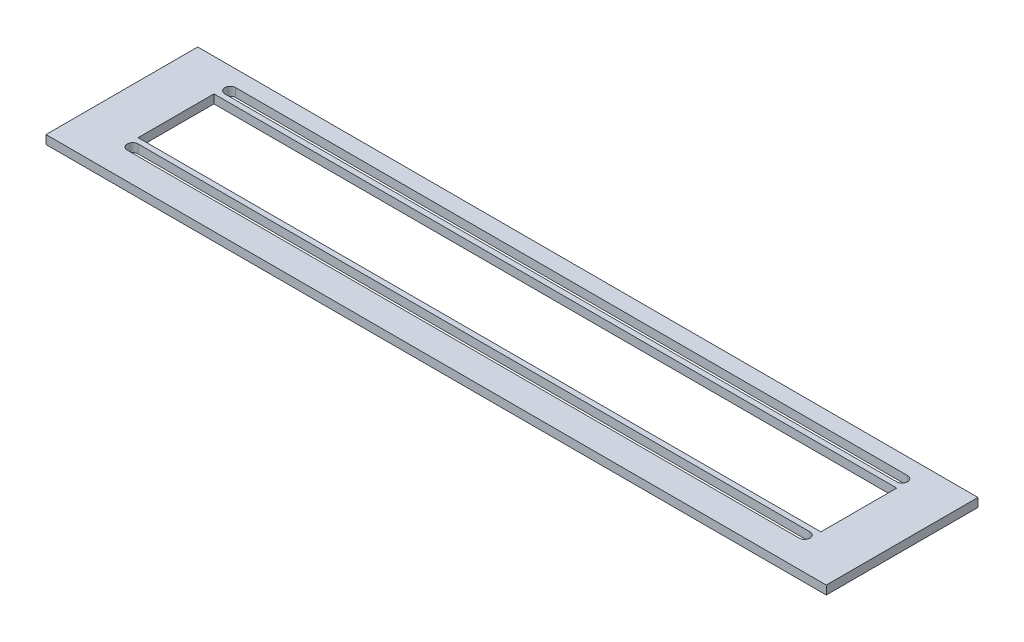
from build123d import *

# Parameters (mm, degrees)
SKETCH_1_W          = 360
SKETCH_1_H          = 70
EXTRUDE_1_DEPTH     = 4
CUT_EXTRUDE_1_DEPTH = 367.764229444
CUT_EXTRUDE_2_DEPTH = 367.764229444
SKETCH_4_W          = 310
SKETCH_4_H          = 35
SKETCH_4_W_2        = 2.5
CUT_EXTRUDE_3_DEPTH = 367.764229444


with BuildPart() as part:
    # 草图1 → 凸台-拉伸1 (new body)
    with BuildSketch(Plane(origin=(0, 0, 0), x_dir=(1, 0, 0), z_dir=(0, 1, 0))):
        with Locations((180, -35)):
            Rectangle(SKETCH_1_W, SKETCH_1_H)
    extrude(amount=EXTRUDE_1_DEPTH)

    # 草图2 → 切除-拉伸1 (cut, through all)
    with BuildSketch(Plane(origin=(0, 4, 0), x_dir=(1, 0, 0), z_dir=(0, 1, 0))):
        with BuildLine():
            Line((22.5, -55), (25, -55))
            Line((25, -55), (335, -55))
            Line((335, -55), (337.5, -55))
            ThreePointArc((337.5, -55), (336.767766953, -53.232233047), (335, -52.5))
            Line((335, -52.5), (25, -52.5))
            ThreePointArc((25, -52.5), (23.232233047, -53.232233047), (22.5, -55))
        make_face()
        with BuildLine():
            Line((335, -55), (25, -55))
            Line((25, -55), (22.5, -55))
            ThreePointArc((22.5, -55), (23.232233047, -56.767766953), (25, -57.5))
            Line((25, -57.5), (335, -57.5))
            ThreePointArc((335, -57.5), (336.767766953, -56.767766953), (337.5, -55))
            Line((337.5, -55), (335, -55))
        make_face()
    extrude(amount=-CUT_EXTRUDE_1_DEPTH, mode=Mode.SUBTRACT)

    # 草图3 → 切除-拉伸2 (cut, through all)
    with BuildSketch(Plane.XZ):
        with BuildLine():
            Line((25, 12.5), (335, 12.5))
            ThreePointArc((335, 12.5), (337.5, 10), (335, 7.5))
            Line((335, 7.5), (25, 7.5))
            ThreePointArc((25, 7.5), (22.5, 10), (25, 12.5))
        make_face()
    extrude(amount=-CUT_EXTRUDE_2_DEPTH, mode=Mode.SUBTRACT)

    # 草图4 → 切除-拉伸3 (cut, through all)
    with BuildSketch(Plane.XZ):
        with Locations((180, 32.5)):
            Rectangle(SKETCH_4_W, SKETCH_4_H)
        with Locations((23.75, 32.5)):
            Rectangle(SKETCH_4_W_2, SKETCH_4_H)
        with Locations((336.25, 32.5)):
            Rectangle(SKETCH_4_W_2, SKETCH_4_H)
    extrude(amount=-CUT_EXTRUDE_3_DEPTH, mode=Mode.SUBTRACT)


solid = part.part
